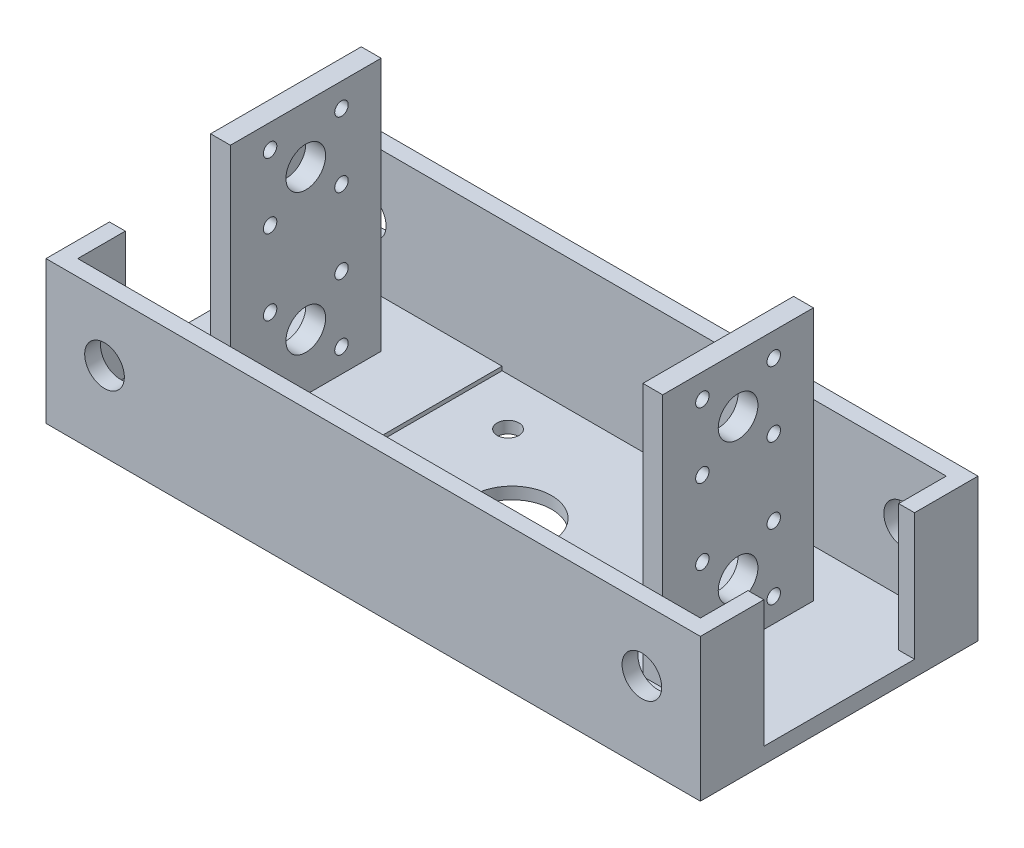
from build123d import *

# Parameters (mm, degrees)
SKETCH1_W                 = 75
SKETCH1_H                 = 40
SKETCH1_R                 = 5
SKETCH1_R_2               = 1.7
SKETCH1_W_2               = 10
SKETCH1_H_2               = 20
BOSS_EXTRUDE1_DEPTH       = 3
CUT_EXTRUDE1_DEPTH        = 43.605750786
CUT_EXTRUDE1_DEPTH_BACK   = 43.605750786
SKETCH2_W                 = 67
SKETCH2_H                 = 28
BOSS_EXTRUDE3_DEPTH       = 110
BOSS_EXTRUDE3_DEPTH_BACK  = 3
SKETCH6_W                 = 67
SKETCH6_H                 = 11
CUT_EXTRUDE4_DEPTH        = 122.372360939
SKETCH7_W                 = 70
SKETCH7_H                 = 37
BOSS_EXTRUDE4_DEPTH       = 45
SKETCH8_W                 = 45
SKETCH8_H                 = 62
CUT_EXTRUDE6_DEPTH        = 29
SKETCH11_W                = 45
SKETCH11_H                = 4
CUT_EXTRUDE9_DEPTH        = 157.445677473
SKETCH9_W                 = 38
SKETCH9_H                 = 28.5
CUT_EXTRUDE10_DEPTH       = 204.024629048
SKETCH13_W                = 5
SKETCH13_H                = 38
BOSS_EXTRUDE5_DEPTH       = 32
SKETCH14_R                = 5
SKETCH14_R_2              = 1.7
CUT_EXTRUDE11_DEPTH       = 32
SKETCH15_W                = 165
SKETCH15_H                = 70
SKETCH15_W_2              = 157
SKETCH15_H_2              = 62
BOSS_EXTRUDE6_DEPTH       = 3
SKETCH16_W                = 20
SKETCH16_H                = 4.820648258
CUT_EXTRUDE12_DEPTH       = 159.626132778
SKETCH18_R                = 5
CUT_EXTRUDE14_DEPTH       = 159.626132778
MIRROR6_COPY_1_SKETCH_W   = 5
MIRROR6_COPY_1_SKETCH_H   = 38
MIRROR6_COPY_1_DEPTH      = 32
MIRROR6_COPY_2_SKETCH_R   = 5
MIRROR6_COPY_2_SKETCH_R_2 = 1.7
MIRROR6_COPY_2_DEPTH      = 32
SKETCH19_W                = 38
SKETCH19_H                = 3.5
CUT_EXTRUDE15_DEPTH       = 10
SKETCH20_R                = 1.2
CUT_EXTRUDE16_DEPTH       = 10
SKETCH21_W                = 10
SKETCH21_H                = 80
CUT_EXTRUDE17_DEPTH       = 184.330984833
SKETCH22_W                = 55
SKETCH22_H                = 80
CUT_EXTRUDE18_DEPTH       = 184.330984833
SKETCH23_W                = 67
SKETCH23_H                = 62
BOSS_EXTRUDE7_DEPTH       = 3
SKETCH24_R                = 10
SKETCH24_R_2              = 2.75
CUT_EXTRUDE19_DEPTH       = 111.707949127


with BuildPart() as part:
    # Sketch1 → Boss-Extrude1 (new body)
    with BuildSketch(Plane(origin=(0, 0, 0), x_dir=(1, 0, 0), z_dir=(0, 1, 0))):
        Rectangle(SKETCH1_W, SKETCH1_H)
        with Locations(Location((-21, 0, 0), (0, 0, 270))):
            Circle(SKETCH1_R, mode=Mode.SUBTRACT)
        with Locations(Location((-30, 8.25, 0), (0, 0, 270))):
            Circle(SKETCH1_R_2, mode=Mode.SUBTRACT)
        with Locations(Location((-12, 8.25, 0), (0, 0, 270))):
            Circle(SKETCH1_R_2, mode=Mode.SUBTRACT)
        with Locations(Location((-12, -8.25, 0), (0, 0, 270))):
            Circle(SKETCH1_R_2, mode=Mode.SUBTRACT)
        with Locations(Location((-30, -8.25, 0), (0, 0, 270))):
            Circle(SKETCH1_R_2, mode=Mode.SUBTRACT)
        with Locations(Location((12, 8.25, 0), (0, 0, 90))):
            Circle(SKETCH1_R_2, mode=Mode.SUBTRACT)
        with Locations(Location((12, -8.25, 0), (0, 0, 90))):
            Circle(SKETCH1_R_2, mode=Mode.SUBTRACT)
        with Locations(Location((21, 0, 0), (0, 0, 90))):
            Circle(SKETCH1_R, mode=Mode.SUBTRACT)
        with Locations(Location((30, -8.25, 0), (0, 0, 90))):
            Circle(SKETCH1_R_2, mode=Mode.SUBTRACT)
        with Locations(Location((30, 8.25, 0), (0, 0, 90))):
            Circle(SKETCH1_R_2, mode=Mode.SUBTRACT)
        Rectangle(SKETCH1_W_2, SKETCH1_H_2, mode=Mode.SUBTRACT)
    extrude(amount=BOSS_EXTRUDE1_DEPTH)

    # Sketch2 → Cut-Extrude1 (cut, two sides: drawn at the far end of the back side and taken through both)
    with BuildSketch(Plane(origin=(0, 3, 0), x_dir=(1, 0, 0), z_dir=(0, 1, 0)).offset(-CUT_EXTRUDE1_DEPTH_BACK)):
        Rectangle(SKETCH2_W, SKETCH2_H)
    extrude(amount=CUT_EXTRUDE1_DEPTH + CUT_EXTRUDE1_DEPTH_BACK, mode=Mode.SUBTRACT)

    # Sketch3 → Boss-Extrude3 (add, two sides: drawn at the far end of the back side and taken through both)
    with BuildSketch(Plane(origin=(0, 3, 0), x_dir=(1, 0, 0), z_dir=(0, 1, 0)).offset(-BOSS_EXTRUDE3_DEPTH_BACK)):
        Polygon((37.5, -35), (37.5, -20), (33.5, -20), (-33.5, -20), (-37.5, -20), (-37.5, -35), align=None)
        Polygon((33.5, 20), (37.5, 20), (37.5, 35), (-37.5, 35), (-37.5, 20), (-33.5, 20), align=None)
        Polygon((37.5, -20), (37.5, 20), (33.5, 20), (33.5, 14), (33.5, -14), (33.5, -20), align=None)
        Polygon((-33.5, 14), (-33.5, 20), (-37.5, 20), (-37.5, -20), (-33.5, -20), (-33.5, -14), align=None)
    extrude(amount=BOSS_EXTRUDE3_DEPTH + BOSS_EXTRUDE3_DEPTH_BACK)

    # Sketch6 → Cut-Extrude4 (cut, through all)
    with BuildSketch(Plane(origin=(0, 3, 0), x_dir=(1, 0, 0), z_dir=(0, 1, 0))):
        with Locations((0, -25.5)):
            Rectangle(SKETCH6_W, SKETCH6_H)
        with Locations((0, 25.5)):
            Rectangle(SKETCH6_W, SKETCH6_H)
    extrude(amount=CUT_EXTRUDE4_DEPTH, mode=Mode.SUBTRACT)

    # Sketch7 → Boss-Extrude4 (add)
    with BuildSketch(Plane.ZY.offset(37.5)):
        with Locations((0, 94.5)):
            Rectangle(SKETCH7_W, SKETCH7_H)
    boss_extrude4 = extrude(amount=BOSS_EXTRUDE4_DEPTH)

    # Mirror2: Boss-Extrude4 across plane
    add(boss_extrude4.mirror(Plane(origin=(0, 0, 0), x_dir=(0, 0, 1), z_dir=(1, 0, 0))))

    # Sketch8 → Cut-Extrude6 (cut)
    with BuildSketch(Plane(origin=(0, 113, 0), x_dir=(1, 0, 0), z_dir=(0, 1, 0))):
        with Locations((-56, 0)):
            Rectangle(SKETCH8_W, SKETCH8_H)
        with Locations((56, 0)):
            Rectangle(SKETCH8_W, SKETCH8_H)
    extrude(amount=-CUT_EXTRUDE6_DEPTH, mode=Mode.SUBTRACT)

    # Sketch11 → Cut-Extrude9 (cut, through all)
    with BuildSketch(Plane.XY.offset(35)):
        with Locations((-60, 78)):
            Rectangle(SKETCH11_W, SKETCH11_H)
        with Locations((60, 78)):
            Rectangle(SKETCH11_W, SKETCH11_H)
    extrude(amount=-CUT_EXTRUDE9_DEPTH, mode=Mode.SUBTRACT)

    # Sketch9 → Cut-Extrude10 (cut, through all)
    with BuildSketch(Plane.ZY.offset(82.5)):
        with Locations((0, 98.25)):
            Rectangle(SKETCH9_W, SKETCH9_H)
    extrude(amount=-CUT_EXTRUDE10_DEPTH, mode=Mode.SUBTRACT)

    # Sketch13 → Boss-Extrude5 (add)
    with BuildSketch(Plane(origin=(0, 84, 0), x_dir=(1, 0, 0), z_dir=(0, 1, 0))):
        with Locations((-54.5, 0)):
            Rectangle(SKETCH13_W, SKETCH13_H)
    boss_extrude5 = extrude(amount=BOSS_EXTRUDE5_DEPTH)

    # Sketch14 → Cut-Extrude11 (cut)
    with BuildSketch(Plane.ZY.offset(57)):
        with Locations((0, 98.25)):
            Circle(SKETCH14_R)
        with Locations((-9, 106.5)):
            Circle(SKETCH14_R_2)
        with Locations((9, 106.5)):
            Circle(SKETCH14_R_2)
        with Locations((9, 90)):
            Circle(SKETCH14_R_2)
        with Locations((-9, 90)):
            Circle(SKETCH14_R_2)
    cut_extrude11 = extrude(amount=-CUT_EXTRUDE11_DEPTH, mode=Mode.SUBTRACT)

    # Mirror4: Boss-Extrude5, Cut-Extrude11 across plane
    add(boss_extrude5.mirror(Plane(origin=(0, 0, 0), x_dir=(0, 0, 1), z_dir=(1, 0, 0))))
    add(cut_extrude11.mirror(Plane(origin=(0, 0, 0), x_dir=(0, 0, 1), z_dir=(1, 0, 0))), mode=Mode.SUBTRACT)

    # Sketch15 → Boss-Extrude6 (add)
    with BuildSketch(Plane(origin=(0, 113, 0), x_dir=(1, 0, 0), z_dir=(0, 1, 0))):
        Rectangle(SKETCH15_W, SKETCH15_H)
        Rectangle(SKETCH15_W_2, SKETCH15_H_2, mode=Mode.SUBTRACT)
    extrude(amount=BOSS_EXTRUDE6_DEPTH)

    # Sketch16 → Cut-Extrude12 (cut, through all)
    with BuildSketch(Plane.XY.offset(35)):
        with Locations((0, 11.636111214)):
            Rectangle(SKETCH16_W, SKETCH16_H)
    extrude(amount=-CUT_EXTRUDE12_DEPTH, mode=Mode.SUBTRACT)

    # Sketch18 → Cut-Extrude14 (cut, through all)
    with BuildSketch(Plane.XY.offset(35)):
        with Locations((67.75, 100)):
            Circle(SKETCH18_R)
    cut_extrude14 = extrude(amount=-CUT_EXTRUDE14_DEPTH, mode=Mode.SUBTRACT)

    # Mirror5: Cut-Extrude14 across plane
    add(cut_extrude14.mirror(Plane(origin=(0, 0, 0), x_dir=(0, 0, 1), z_dir=(1, 0, 0))), mode=Mode.SUBTRACT)

    # Mirror6: Boss-Extrude5, Cut-Extrude11 across plane
    add(boss_extrude5.mirror(Plane.ZX.offset(116)))
    add(cut_extrude11.mirror(Plane.ZX.offset(116)), mode=Mode.SUBTRACT)

    # Mirror6 copy 1 sketch → Mirror6 copy 1 (add)
    with BuildSketch(Plane(origin=(0, 148, 0), x_dir=(-1, 0, 0), z_dir=(0, -1, 0))):
        with Locations((-54.5, 0)):
            Rectangle(MIRROR6_COPY_1_SKETCH_W, MIRROR6_COPY_1_SKETCH_H)
    extrude(amount=MIRROR6_COPY_1_DEPTH)

    # Mirror6 copy 2 sketch → Mirror6 copy 2 (cut)
    with BuildSketch(Plane(origin=(57, 232, 0), x_dir=(0, 0, 1), z_dir=(1, 0, 0))):
        with Locations((0, 98.25)):
            Circle(MIRROR6_COPY_2_SKETCH_R)
        with Locations((-9, 106.5)):
            Circle(MIRROR6_COPY_2_SKETCH_R_2)
        with Locations((9, 106.5)):
            Circle(MIRROR6_COPY_2_SKETCH_R_2)
        with Locations((9, 90)):
            Circle(MIRROR6_COPY_2_SKETCH_R_2)
        with Locations((-9, 90)):
            Circle(MIRROR6_COPY_2_SKETCH_R_2)
    extrude(amount=-MIRROR6_COPY_2_DEPTH, mode=Mode.SUBTRACT)

    # Sketch19 → Cut-Extrude15 (cut)
    with BuildSketch(Plane(origin=(82.5, 0, 0), x_dir=(0, 0, -1), z_dir=(1, 0, 0))):
        with Locations((0, 114.25)):
            Rectangle(SKETCH19_W, SKETCH19_H)
    cut_extrude15 = extrude(amount=-CUT_EXTRUDE15_DEPTH, mode=Mode.SUBTRACT)

    # Mirror7: Cut-Extrude15 across plane
    add(cut_extrude15.mirror(Plane(origin=(0, 0, 0), x_dir=(0, 0, 1), z_dir=(1, 0, 0))), mode=Mode.SUBTRACT)

    # Sketch20 → Cut-Extrude16 (cut)
    with BuildSketch(Plane(origin=(0, 3, 0), x_dir=(1, 0, 0), z_dir=(0, 1, 0))):
        with Locations(Location((-24, 17.5, 0), (0, 0, 270))):
            Circle(SKETCH20_R)
        with Locations(Location((-12, 17.5, 0), (0, 0, 270))):
            Circle(SKETCH20_R)
        with Locations(Location((12, 17.5, 0), (0, 0, 270))):
            Circle(SKETCH20_R)
        with Locations(Location((-24, -17.5, 0), (0, 0, 270))):
            Circle(SKETCH20_R)
        with Locations(Location((-12, -17.5, 0), (0, 0, 270))):
            Circle(SKETCH20_R)
        with Locations(Location((24, 17.5, 0), (0, 0, 270))):
            Circle(SKETCH20_R)
        with Locations(Location((12, -17.5, 0), (0, 0, 270))):
            Circle(SKETCH20_R)
        with Locations(Location((24, -17.5, 0), (0, 0, 270))):
            Circle(SKETCH20_R)
    extrude(amount=-CUT_EXTRUDE16_DEPTH, mode=Mode.SUBTRACT)

    # Sketch21 → Cut-Extrude17 (cut, through all)
    with BuildSketch(Plane.XY.offset(35)):
        with Locations((32.5, 40)):
            Rectangle(SKETCH21_W, SKETCH21_H)
        with Locations((-32.5, 40)):
            Rectangle(SKETCH21_W, SKETCH21_H)
    extrude(amount=-CUT_EXTRUDE17_DEPTH, mode=Mode.SUBTRACT)

    # Sketch22 → Cut-Extrude18 (cut, through all)
    with BuildSketch(Plane.XY.offset(35)):
        with Locations((0, 40)):
            Rectangle(SKETCH22_W, SKETCH22_H)
    extrude(amount=-CUT_EXTRUDE18_DEPTH, mode=Mode.SUBTRACT)

    # Sketch23 → Boss-Extrude7 (add)
    with BuildSketch(Plane.XZ.offset(-80)):
        Rectangle(SKETCH23_W, SKETCH23_H)
    extrude(amount=-BOSS_EXTRUDE7_DEPTH)

    # Sketch24 → Cut-Extrude19 (cut, through all)
    with BuildSketch(Plane(origin=(0, 83, 0), x_dir=(1, 0, 0), z_dir=(0, 1, 0))):
        with Locations(Location((0, 0, 0), (0, 0, 270))):
            Circle(SKETCH24_R)
        with Locations(Location((-20, 19, 0), (0, 0, 270))):
            Circle(SKETCH24_R_2)
        with Locations(Location((-20, -19, 0), (0, 0, 270))):
            Circle(SKETCH24_R_2)
        with Locations(Location((20, -19, 0), (0, 0, 90))):
            Circle(SKETCH24_R_2)
        with Locations(Location((20, 19, 0), (0, 0, 90))):
            Circle(SKETCH24_R_2)
    extrude(amount=-CUT_EXTRUDE19_DEPTH, mode=Mode.SUBTRACT)


solid = part.part
